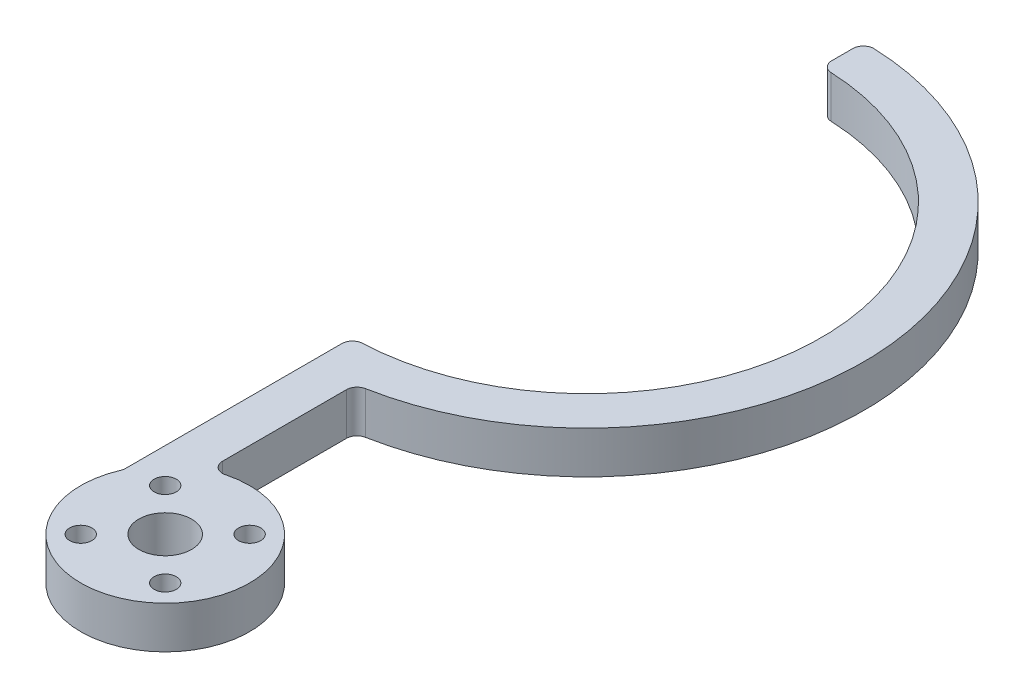
from build123d import *

# Parameters (mm, degrees)
SKETCH1_R           = 2.1
SKETCH1_R_2         = 5
BOSS_EXTRUDE2_DEPTH = 8
FILLET1_R           = 2


with BuildPart() as part:
    # Sketch1 → Boss-Extrude2 (new body)
    with BuildSketch(Plane(origin=(0, 0, 0), x_dir=(1, 0, 0), z_dir=(0, 1, 0))):
        with BuildLine():
            Line((0, 52.45), (0, 44.45))
            ThreePointArc((0, 44.45), (44.45, 0), (0, -44.45))
            Line((0, -44.45), (0, -87.795530451))
            ThreePointArc((0, -87.795530451), (25.844530788, -105.772355994), (8, -79.836304845))
            Line((8, -79.836304845), (8, -51.836304845))
            ThreePointArc((8, -51.836304845), (52.296351159, 4.011752165), (0, 52.45))
        make_face()
        with Locations(Location((22.559764633, -86.429779002, 0), (0, 0, 270))):
            Circle(SKETCH1_R, mode=Mode.SUBTRACT)
        with Locations(Location((22.559764633, -102.429779002, 0), (0, 0, 270))):
            Circle(SKETCH1_R, mode=Mode.SUBTRACT)
        with Locations(Location((6.559764633, -102.429779002, 0), (0, 0, 270))):
            Circle(SKETCH1_R, mode=Mode.SUBTRACT)
        with Locations(Location((6.559764633, -86.429779002, 0), (0, 0, 270))):
            Circle(SKETCH1_R, mode=Mode.SUBTRACT)
        with Locations(Location((14.559764633, -94.429779002, 0), (0, 0, 270))):
            Circle(SKETCH1_R_2, mode=Mode.SUBTRACT)
    extrude(amount=BOSS_EXTRUDE2_DEPTH)

    # Fillet1
    fillet1_edges = [part.edges().sort_by_distance(p)[0] for p in [
        (0, 4, 44.45),
        (0, 4, -44.45),
        (0, 4, -52.45),
        (8, 4, 51.836304845),
        (8, 4, 79.836304845),
        (0, 4, 87.795530451),
    ]]
    fillet(fillet1_edges, radius=FILLET1_R)


solid = part.part
